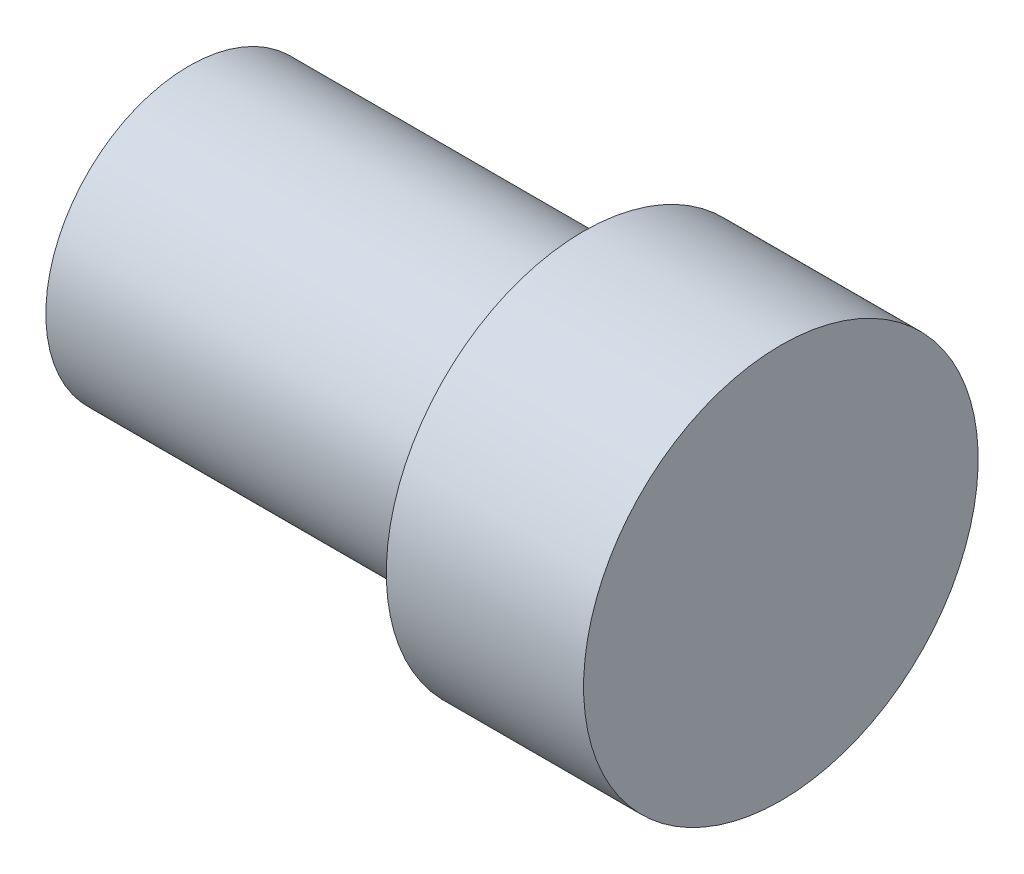
from build123d import *


with BuildPart() as part:
    # Sketch1 → Revolve1 (revolve)
    with BuildSketch(Plane.XY):
        Polygon((0, 0), (20, 0), (20, 2.74305604), (30, 2.74305604), (30, -7.25694396), (0, -7.25694396), align=None)
    revolve(axis=Axis((30, -7.25694396, 0), (-1, 0, 0)))


solid = part.part
